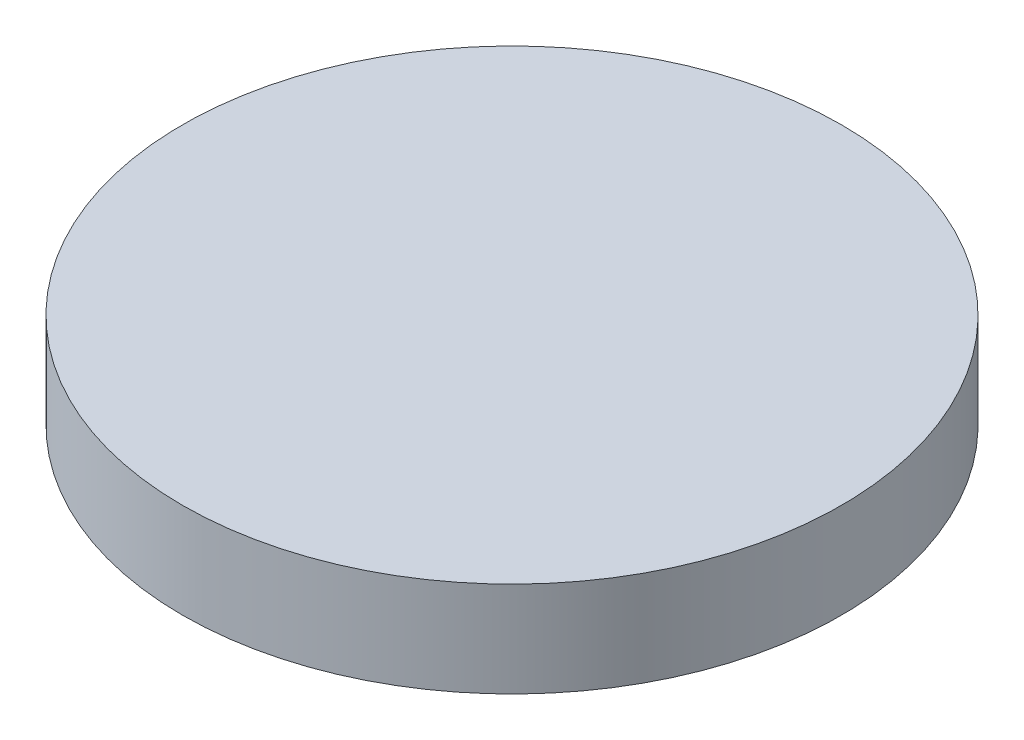
from build123d import *

# Parameters (mm, degrees)
SKETCH1_R           = 34.632866175
BOSS_EXTRUDE1_DEPTH = 10


with BuildPart() as part:
    # Sketch1 → Boss-Extrude1 (new body)
    with BuildSketch(Plane(origin=(0, 0, 0), x_dir=(1, 0, 0), z_dir=(0, 1, 0))):
        with Locations(Location((0, 0, 0), (0, 0, 270))):
            Circle(SKETCH1_R)
    extrude(amount=BOSS_EXTRUDE1_DEPTH)


solid = part.part
